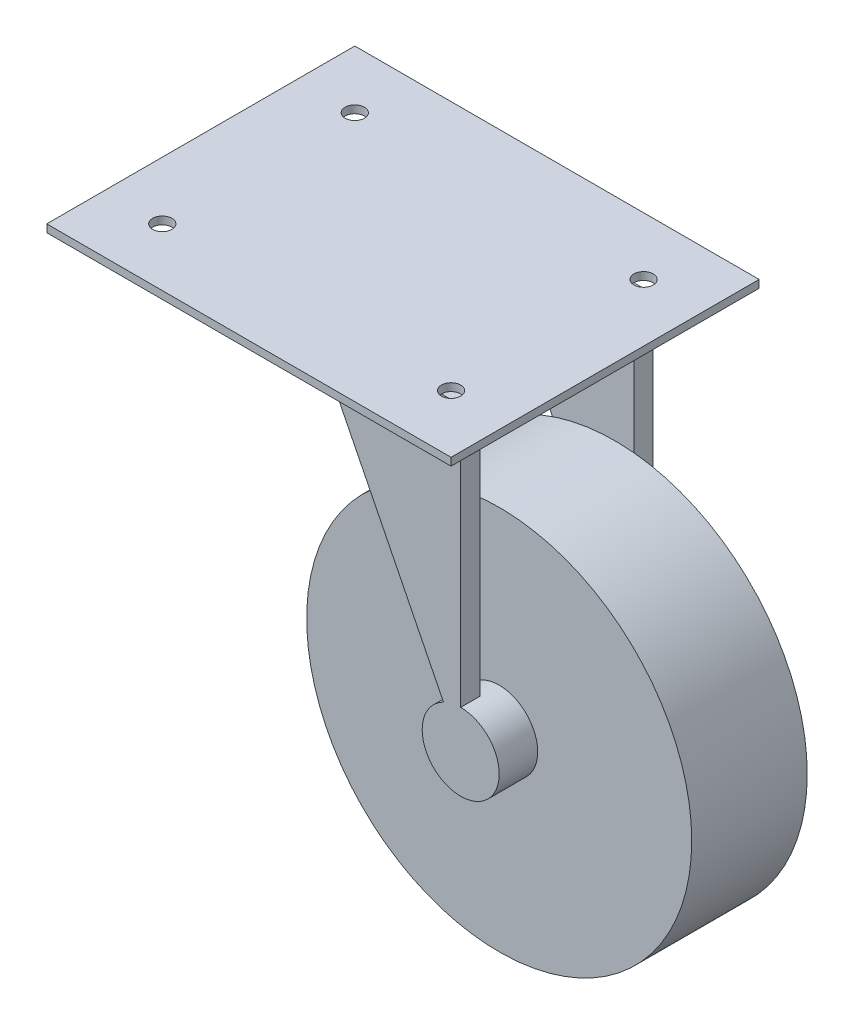
from build123d import *

# Parameters (mm, degrees)
SCHIZZO1_R                   = 50
ESTRUSIONE_ESTRUSIONE1_DEPTH = 30
SCHIZZO2_R                   = 10
ESTRUSIONE_ESTRUSIONE2_DEPTH = 5
ESTRUSIONE_ESTRUSIONE3_START = 5
SCHIZZO3_R                   = 10
ESTRUSIONE_ESTRUSIONE3_DEPTH = 5
SCHIZZO4_R                   = 10
ESTRUSIONE_ESTRUSIONE4_DEPTH = 5
ESTRUSIONE_ESTRUSIONE5_START = 5
SCHIZZO5_R                   = 10
ESTRUSIONE_ESTRUSIONE5_DEPTH = 5
SCHIZZO6_W                   = 105
SCHIZZO6_H                   = 80
ESTRUSIONE_ESTRUSIONE6_DEPTH = 2
SCHIZZO7_R                   = 2.5
TAGLIO_ESTRUSIONE1_DEPTH     = 2


with BuildPart() as part:
    # Schizzo1 → Estrusione-Estrusione1 (new body)
    with BuildSketch(Plane.XY):
        Circle(SCHIZZO1_R)
    extrude(amount=ESTRUSIONE_ESTRUSIONE1_DEPTH)

    # Schizzo2 → Estrusione-Estrusione2 (add)
    with BuildSketch(Plane.XY.offset(30)):
        Circle(SCHIZZO2_R)
    extrude(amount=ESTRUSIONE_ESTRUSIONE2_DEPTH)

    # Schizzo3 → Estrusione-Estrusione3 (add)
    with BuildSketch(Plane(origin=(0, 0, 0), x_dir=(-1, 0, 0), z_dir=(0, 0, -1)).offset(ESTRUSIONE_ESTRUSIONE3_START)):
        with Locations(Location((0, 0, 0), (0, 0, 180))):
            Circle(SCHIZZO3_R)
    extrude(amount=-ESTRUSIONE_ESTRUSIONE3_DEPTH)

    # Schizzo4 → Estrusione-Estrusione4 (add)
    with BuildSketch(Plane.XY.offset(35)):
        with Locations(Location((0, 0, 0), (0, 0, 116.565051177))):
            Circle(SCHIZZO4_R)
        Polygon((0, 80), (-40, 80), (0, 0), align=None)
        with BuildLine():
            Line((-4.472135955, 8.94427191), (0, 0))
            Line((0, 0), (0, 10))
            ThreePointArc((0, 10), (-2.297529205, 9.732489895), (-4.472135955, 8.94427191))
        make_face()
        with BuildLine():
            Line((0, 10), (0, 0))
            Line((0, 0), (-4.472135955, 8.94427191))
            ThreePointArc((-4.472135955, 8.94427191), (-5.257311121, -8.506508084), (10, 0))
            ThreePointArc((10, 0), (7.071067812, 7.071067812), (0, 10))
        make_face()
    extrude(amount=ESTRUSIONE_ESTRUSIONE4_DEPTH)

    # Schizzo5 → Estrusione-Estrusione5 (add)
    with BuildSketch(Plane(origin=(0, 0, -5), x_dir=(-1, 0, 0), z_dir=(0, 0, -1)).offset(ESTRUSIONE_ESTRUSIONE5_START)):
        with Locations(Location((0, 0, 0), (0, 0, 63.434948823))):
            Circle(SCHIZZO5_R)
        Polygon((40, 80), (0, 0), (0, 80), align=None)
        with BuildLine():
            Line((4.472135955, 8.94427191), (0, 0))
            Line((0, 0), (0, 10))
            ThreePointArc((0, 10), (-7.071067812, -7.071067812), (10, 0))
            ThreePointArc((10, 0), (8.506508084, 5.257311121), (4.472135955, 8.94427191))
        make_face()
        with BuildLine():
            Line((0, 10), (0, 0))
            Line((0, 0), (4.472135955, 8.94427191))
            ThreePointArc((4.472135955, 8.94427191), (2.297529205, 9.732489895), (0, 10))
        make_face()
    extrude(amount=-ESTRUSIONE_ESTRUSIONE5_DEPTH)

    # Schizzo6 → Estrusione-Estrusione6 (add)
    with BuildSketch(Plane(origin=(0, 80, 0), x_dir=(1, 0, 0), z_dir=(0, 1, 0))):
        with Locations((-40, -15)):
            Rectangle(SCHIZZO6_W, SCHIZZO6_H)
    extrude(amount=-ESTRUSIONE_ESTRUSIONE6_DEPTH)

    # Schizzo7 → Taglio-Estrusione1 (cut)
    with BuildSketch(Plane(origin=(0, 80, 0), x_dir=(1, 0, 0), z_dir=(0, 1, 0))):
        with Locations(Location((-77.5, -40, 0), (0, 0, 270))):
            Circle(SCHIZZO7_R)
        with Locations(Location((-2.5, -40, 0), (0, 0, 180))):
            Circle(SCHIZZO7_R)
        with Locations(Location((-2.5, 10, 0), (0, 0, 270))):
            Circle(SCHIZZO7_R)
        with Locations(Location((-77.5, 10, 0), (0, 0, 90))):
            Circle(SCHIZZO7_R)
    extrude(amount=-TAGLIO_ESTRUSIONE1_DEPTH, mode=Mode.SUBTRACT)


solid = part.part
